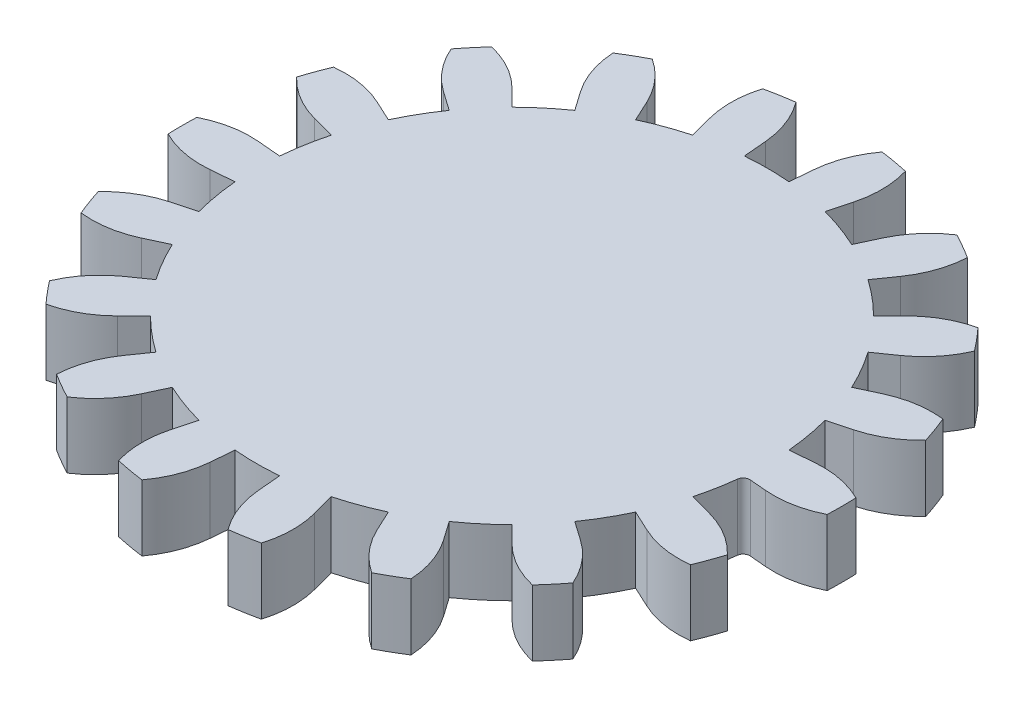
from build123d import *

# Parameters (mm, degrees)
BOSS_EXTRUDE1_DEPTH = 10
FILLET4_R           = 1
CIRPATTERN1_COUNT   = 18


with BuildPart() as part:
    # Sketch1 → Boss-Extrude1 (new body)
    with BuildSketch(Plane(origin=(0, 0, 0), x_dir=(1, 0, 0), z_dir=(0, 1, 0))):
        with BuildLine():
            ThreePointArc((38.602544551, -3.377285031), (38.418488378, -5.057889949), (38.161300429, -6.728866885))
            Line((38.161300429, -6.728866885), (0, 0))
            Line((0, 0), (38.161300429, 6.728866885))
            ThreePointArc((38.161300429, 6.728866885), (38.418488378, 5.057889949), (38.602544551, 3.377285031))
            Line((38.602544551, 3.377285031), (42.124092809, 3.685380582))
            ThreePointArc((42.124092809, 3.685380582), (46.141395468, 3.478911596), (49.948794335, 2.180811458))
            ThreePointArc((49.948794335, 2.180811458), (49.99637981, 0), (49.948794335, -2.180811458))
            ThreePointArc((49.948794335, -2.180811458), (46.141395468, -3.478911596), (42.124092809, -3.685380582))
            Line((42.124092809, -3.685380582), (38.602544551, -3.377285031))
        make_face()
    boss_extrude1 = extrude(amount=BOSS_EXTRUDE1_DEPTH)

    # Fillet4
    fillet4_edges = [part.edges().sort_by_distance(p)[0] for p in [
        (38.602544551, 5, 3.377285031),
    ]]
    fillet(fillet4_edges, radius=FILLET4_R)

    # CirPattern1: Boss-Extrude1 ×18 about axis
    cirpattern1_axis = Axis((0, 0, 0), (0, 1, 0))
    for i in range(1, CIRPATTERN1_COUNT):
        add(boss_extrude1.rotate(cirpattern1_axis, i * 360 / CIRPATTERN1_COUNT))


solid = part.part
